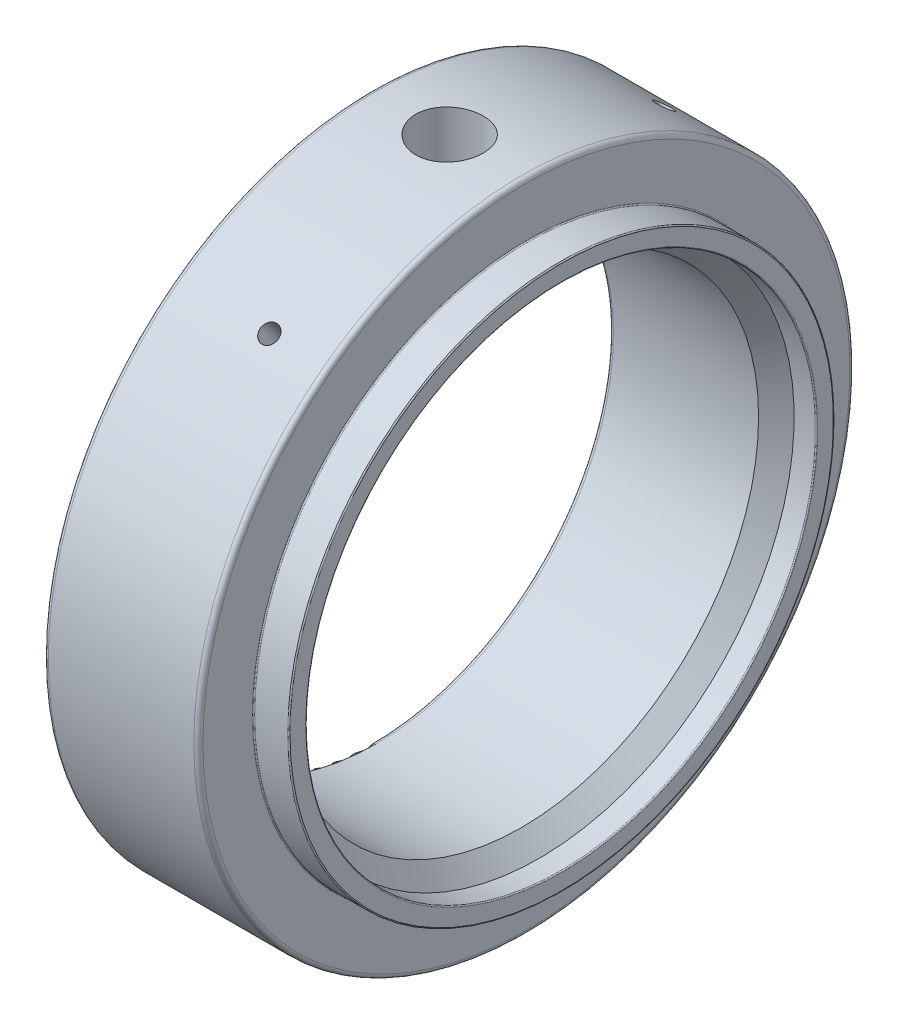
from build123d import *

# Parameters (mm, degrees)
SKETCH4_R          = 3.7
CUT_EXTRUDE2_DEPTH = 6.82
SKETCH6_R          = 1
CUT_EXTRUDE3_DEPTH = 16.82
SKETCH7_R          = 1
CUT_EXTRUDE4_DEPTH = 16.82


with BuildPart() as part:
    # Sketch1 → Revolve1 (revolve)
    with BuildSketch(Plane.XY, mode=Mode.PRIVATE) as revolve1_sk:
        with BuildLine():
            Line((18.38, 27.97), (16.43, 26.02))
            Line((16.43, 26.02), (0.5, 26.02))
            ThreePointArc((0.5, 26.02), (0.146446609, 26.166446609), (0, 26.52))
            Line((0, 26.52), (0, 35.5))
            ThreePointArc((0, 35.5), (0.146446609, 35.853553391), (0.5, 36))
            Line((0.5, 36), (16.47, 36))
            ThreePointArc((16.47, 36), (16.823553391, 35.853553391), (16.97, 35.5))
            Line((16.97, 35.5), (16.97, 30.07))
            ThreePointArc((16.97, 30.07), (17.006611652, 29.981611652), (17.095, 29.945))
            Line((17.095, 29.945), (20.715, 29.945))
            ThreePointArc((20.715, 29.945), (20.803388348, 29.908388348), (20.84, 29.82))
            Line((20.84, 29.82), (20.84, 28.095))
            ThreePointArc((20.84, 28.095), (20.803388348, 28.006611652), (20.715, 27.97))
            Line((20.715, 27.97), (18.38, 27.97))
        make_face()
    revolve(revolve1_sk.sketch.rotate(Axis((0, 0, 0), (1, 0, 0)), 90), axis=Axis((0, 0, 0), (1, 0, 0)))

    # Sketch4 → Cut-Extrude2 (cut)
    with BuildSketch(Plane(origin=(0, 36, 0), x_dir=(1, 0, 0), z_dir=(0, 1, 0))):
        with Locations(Location((8.5475, 0, 0), (0, 0, 270))):
            Circle(SKETCH4_R)
    extrude(amount=-CUT_EXTRUDE2_DEPTH, mode=Mode.SUBTRACT)

    # Sketch6 → Cut-Extrude3 (cut)
    with BuildSketch(Plane(origin=(0, 28.750878362, 21.665340833), x_dir=(-1, 0, 0), z_dir=(0, 0.7986355100472962, 0.6018150231520439))):
        with Locations(Location((-10.42, 0, 0), (0, 0, 90))):
            Circle(SKETCH6_R)
    extrude(amount=-CUT_EXTRUDE3_DEPTH, mode=Mode.SUBTRACT)

    # Sketch7 → Cut-Extrude4 (cut)
    with BuildSketch(Plane(origin=(0, 28.750878362, -21.665340833), x_dir=(-1, 0, 0), z_dir=(0, 0.7986355100472878, -0.6018150231520549))):
        with Locations(Location((-10.42, 0, 0), (0, 0, 90))):
            Circle(SKETCH7_R)
    extrude(amount=-CUT_EXTRUDE4_DEPTH, mode=Mode.SUBTRACT)


solid = part.part
